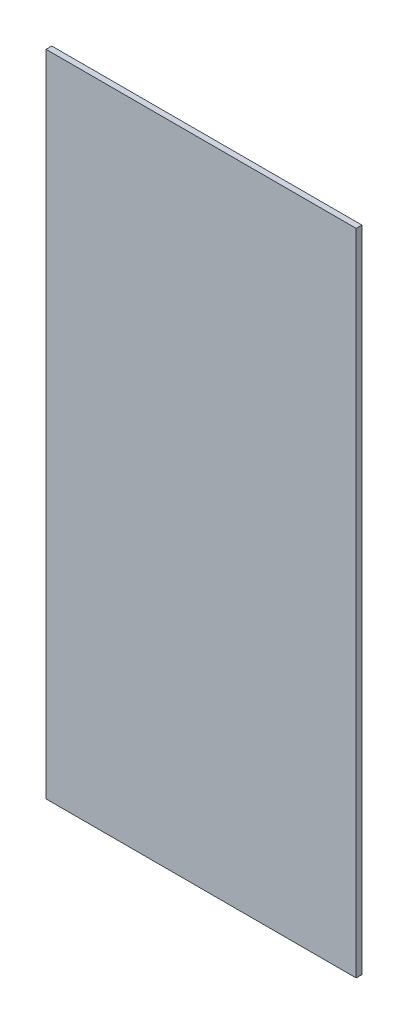
from build123d import *

# Parameters (mm, degrees)
BOSS_EXTRUDE1_DEPTH = 1.6


with BuildPart() as part:
    # Sketch1 → Boss-Extrude1 (new body)
    with BuildSketch(Plane.XY):
        Polygon((-43, -50), (-43, -130), (43, -130), (43, -50), (43, 50), (-43, 50), align=None)
    extrude(amount=BOSS_EXTRUDE1_DEPTH)


solid = part.part
